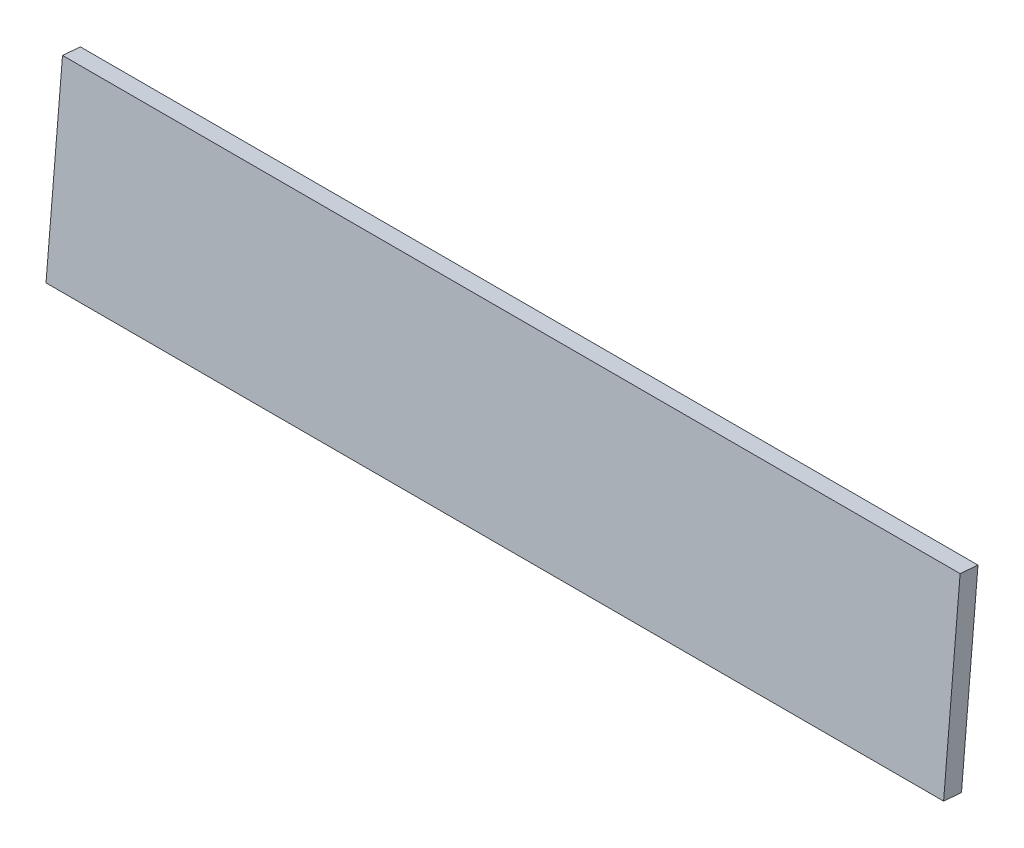
from build123d import *

# Parameters (mm, degrees)
SKETCH1_W         = 450
SKETCH1_H         = 95
BASKET_WALL_DEPTH = 9


with BuildPart() as part:
    # Sketch1 → Basket Wall (new body)
    with BuildSketch(Plane(origin=(0, 0, 0), x_dir=(1, 0, 0), z_dir=(0, 0.08715574274765836, 0.9961946980917455))):
        with Locations((0, 47.5)):
            Rectangle(SKETCH1_W, SKETCH1_H)
    extrude(amount=BASKET_WALL_DEPTH)


solid = part.part
